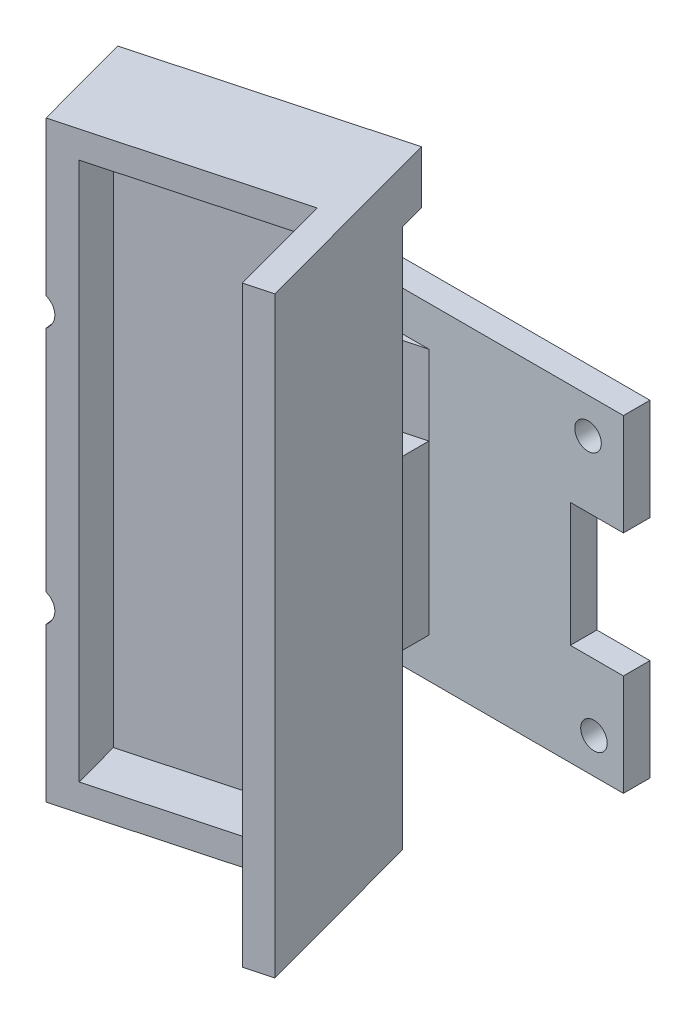
from build123d import *

# Parameters (mm, degrees)
CROQUIS1_W              = 52
CROQUIS1_H              = 37
SALIENTE_EXTRUIR1_DEPTH = 3
REDONDEO1_R             = 3
CROQUIS2_R              = 1.5
CORTAR_EXTRUIR1_DEPTH   = 3
CROQUIS3_W              = 29
CROQUIS3_H              = 20
CROQUIS3_W_2            = 6
CROQUIS3_H_2            = 14
CORTAR_EXTRUIR2_DEPTH   = 3
SALIENTE_EXTRUIR2_DEPTH = 9
CROQUIS5_W              = 36
CROQUIS5_H              = 28.002550662
SALIENTE_EXTRUIR3_DEPTH = 10.3
CORTAR_EXTRUIR3_START   = -28.002551
CORTAR_EXTRUIR3_DEPTH   = 28.002551
SALIENTE_EXTRUIR4_DEPTH = 8.5
CROQUIS8_W              = 21.9
CROQUIS8_H              = 60.9
CORTAR_EXTRUIR4_DEPTH   = 5.5
CORTAR_EXTRUIR5_DEPTH   = 9
CORTAR_EXTRUIR6_START   = -28.002551
CROQUIS12_W             = 9
CROQUIS12_H             = 1.570892211
CORTAR_EXTRUIR6_DEPTH   = 28.002551
CROQUIS13_W             = 3
CROQUIS13_H             = 67
SALIENTE_EXTRUIR5_DEPTH = 12
CORTAR_EXTRUIR7_START   = -28.002551
CROQUIS14_W             = 31
CROQUIS14_H             = 9
CORTAR_EXTRUIR7_DEPTH   = 28.002551
CROQUIS17_R             = 1.5
SALIENTE_EXTRUIR6_DEPTH = 9
CORTAR_EXTRUIR8_START   = -37
CROQUIS18_W             = 54.197150846
CROQUIS18_H             = 9
CORTAR_EXTRUIR8_DEPTH   = 37
CORTAR_EXTRUIR9_REACH   = 83.194
CROQUIS19_R             = 1.5
CROQUIS20_W             = 28
CROQUIS20_H             = 6
SALIENTE_EXTRUIR7_DEPTH = 3
CROQUIS21_W             = 20
CROQUIS21_H             = 4.5
CORTAR_EXTRUIR10_DEPTH  = 2
CROQUIS22_R             = 3
CORTAR_EXTRUIR11_DEPTH  = 10.3
CORTAR_EXTRUIR12_REACH  = 82.263
CROQUIS23_R             = 2


with BuildPart() as part:
    # Croquis1 → Saliente-Extruir1 (new body)
    with BuildSketch(Plane.XY):
        with Locations((-39.296803653, 6.787671233)):
            Rectangle(CROQUIS1_W, CROQUIS1_H)
    extrude(amount=SALIENTE_EXTRUIR1_DEPTH)

    # Redondeo1
    redondeo1_edges = [part.edges().sort_by_distance(p)[0] for p in [
        (-65.296803653, 25.287671233, 1.5),
        (-65.296803653, -11.712328767, 1.5),
    ]]
    fillet(redondeo1_edges, radius=REDONDEO1_R)

    # Croquis2 → Cortar-Extruir1 (cut)
    with BuildSketch(Plane.XY.offset(3)):
        with Locations((-61.296803653, 21.287671233)):
            Circle(CROQUIS2_R)
        with Locations((-61.296803653, -7.712328767)):
            Circle(CROQUIS2_R)
        with Locations((-16.624072342, -7.712328767)):
            Circle(CROQUIS2_R)
        with Locations((-17.296803653, 21.287671233)):
            Circle(CROQUIS2_R)
    extrude(amount=-CORTAR_EXTRUIR1_DEPTH, mode=Mode.SUBTRACT)

    # Croquis3 → Cortar-Extruir2 (cut)
    with BuildSketch(Plane.XY.offset(3)):
        with Locations((-50.796803653, 6.787671233)):
            Rectangle(CROQUIS3_W, CROQUIS3_H)
        with Locations((-16.296803653, 6.787671233)):
            Rectangle(CROQUIS3_W_2, CROQUIS3_H_2)
    extrude(amount=-CORTAR_EXTRUIR2_DEPTH, mode=Mode.SUBTRACT)

    # Croquis4 → Saliente-Extruir2 (add)
    with BuildSketch(Plane.XY.offset(3)):
        Polygon((-57.296803653, 16.787671233), (-57.296803653, 20.790221895), (-26.296803653, 20.790221895), (-26.296803653, -7.212328767), (-57.296803653, -7.212328767), (-57.296803653, -3.212328767), (-36.296803653, -3.212328767), (-36.296803653, 16.787671233), align=None)
    extrude(amount=SALIENTE_EXTRUIR2_DEPTH)

    # Croquis5 → Saliente-Extruir3 (add)
    with BuildSketch(Plane.XY.offset(12)):
        with Locations((-44.296803653, 6.788946564)):
            Rectangle(CROQUIS5_W, CROQUIS5_H)
    extrude(amount=SALIENTE_EXTRUIR3_DEPTH)

    # Croquis6 → Cortar-Extruir3 (cut)
    with BuildSketch(Plane.XZ.offset(7.212328767).offset(CORTAR_EXTRUIR3_START)):
        Polygon((-35.296803653, 15), (-35.296803653, 12.995381041), (-26.296803653, 12.995381041), (-26.296803653, 14.757444162), (-26.296803653, 22.3), (-62.296803653, 22.3), align=None)
    extrude(amount=CORTAR_EXTRUIR3_DEPTH, mode=Mode.SUBTRACT)

    # Croquis7 → Saliente-Extruir4 (add)
    with BuildSketch(Plane(origin=(1.374852463, 0, 5.085070754), x_dir=(0.9653390502996949, 0, -0.2609990765625102), z_dir=(0.2609990765625102, 0, 0.9653390502996949))):
        Polygon((-65.957816682, 6.788946564), (-65.957816682, -26.711053436), (-37.957816682, -26.711053436), (-37.957816682, 40.288946564), (-65.957816682, 40.288946564), align=None)
    extrude(amount=SALIENTE_EXTRUIR4_DEPTH)

    # Croquis8 → Cortar-Extruir4 (cut)
    with BuildSketch(Plane(origin=(3.593344614, 0, 13.290452681), x_dir=(0.9653390502996949, 0, -0.26099907656251026), z_dir=(0.26099907656251026, 0, 0.9653390502996949))):
        with Locations((-51.957816682, 6.788946564)):
            Rectangle(CROQUIS8_W, CROQUIS8_H)
    extrude(amount=-CORTAR_EXTRUIR4_DEPTH, mode=Mode.SUBTRACT)

    # Croquis10 → Cortar-Extruir5 (cut)
    with BuildSketch(Plane(origin=(0, 20.790221895, 0), x_dir=(1, 0, 0), z_dir=(0, 1, 0))):
        Polygon((-62.296803653, -22.3), (-35.296803653, -15), (-35.296803653, -12), (-62.296803653, -19.3), align=None)
    extrude(amount=-CORTAR_EXTRUIR5_DEPTH, mode=Mode.SUBTRACT)

    # Croquis12 → Cortar-Extruir6 (cut)
    with BuildSketch(Plane(origin=(0, 20.790221895, 0), x_dir=(1, 0, 0), z_dir=(0, 1, 0)).offset(CORTAR_EXTRUIR6_START)):
        with Locations((-30.796803653, -12.209934936)):
            Rectangle(CROQUIS12_W, CROQUIS12_H)
    extrude(amount=CORTAR_EXTRUIR6_DEPTH, mode=Mode.SUBTRACT)

    # Croquis13 → Saliente-Extruir5 (add)
    with BuildSketch(Plane(origin=(3.593344614, 0, 13.290452681), x_dir=(0.9653390502996949, 0, -0.26099907656251026), z_dir=(0.26099907656251026, 0, 0.9653390502996949))):
        with Locations((-39.457816682, 6.788946564)):
            Rectangle(CROQUIS13_W, CROQUIS13_H)
    extrude(amount=SALIENTE_EXTRUIR5_DEPTH)

    # Croquis14 → Cortar-Extruir7 (cut)
    with BuildSketch(Plane.XZ.offset(7.212328767).offset(CORTAR_EXTRUIR7_START)):
        with Locations((-41.796803653, 7.5)):
            Rectangle(CROQUIS14_W, CROQUIS14_H)
    extrude(amount=CORTAR_EXTRUIR7_DEPTH, mode=Mode.SUBTRACT)


with BuildPart() as cortar_extruir7_piece_1:
    # of the separate pieces the step leaves, piece 1, a body of its own (cortar_extruir7_pieces)
    add(part.part.solids().sort_by_distance((-62.296803653, -26.711053436, 22.3))[0])



with BuildPart() as cortar_extruir7_piece_2:
    # of the separate pieces the step leaves, piece 2, a body of its own (cortar_extruir7_pieces)
    add(part.part.solids().sort_by_distance((-62.296803653, 25.287671233, 3))[0])


with BuildPart() as cortar_extruir7_piece_1_1:
    add(cortar_extruir7_piece_1.part)

    add(cortar_extruir7_piece_2.part)  # Saliente-Extruir6 merges Cortar-Extruir7 piece 2
    # Croquis17 → Saliente-Extruir6 (add)
    with BuildSketch(Plane.XY.offset(3)):
        with BuildLine():
            Line((-13.296803653, -0.212328767), (-19.296803653, -0.212328767))
            Line((-19.296803653, -0.212328767), (-19.296803653, 13.787671233))
            Line((-19.296803653, 13.787671233), (-13.296803653, 13.787671233))
            Line((-13.296803653, 13.787671233), (-13.296803653, 25.287671233))
            Line((-13.296803653, 25.287671233), (-62.296803653, 25.287671233))
            ThreePointArc((-62.296803653, 25.287671233), (-64.418123997, 24.408991576), (-65.296803653, 22.287671233))
            Line((-65.296803653, 22.287671233), (-65.296803653, 16.787671233))
            Line((-65.296803653, 16.787671233), (-36.296803653, 16.787671233))
            Line((-36.296803653, 16.787671233), (-36.296803653, -3.212328767))
            Line((-36.296803653, -3.212328767), (-65.296803653, -3.212328767))
            Line((-65.296803653, -3.212328767), (-65.296803653, -8.712328767))
            ThreePointArc((-65.296803653, -8.712328767), (-64.418123997, -10.833649111), (-62.296803653, -11.712328767))
            Line((-62.296803653, -11.712328767), (-13.296803653, -11.712328767))
            Line((-13.296803653, -11.712328767), (-13.296803653, -0.212328767))
        make_face()
        with Locations((-61.296803653, 21.287671233)):
            Circle(CROQUIS17_R, mode=Mode.SUBTRACT)
        with Locations((-61.296803653, -7.712328767)):
            Circle(CROQUIS17_R, mode=Mode.SUBTRACT)
        with Locations((-16.624072342, -7.712328767)):
            Circle(CROQUIS17_R, mode=Mode.SUBTRACT)
        with Locations((-17.296803653, 21.287671233)):
            Circle(CROQUIS17_R, mode=Mode.SUBTRACT)
    extrude(amount=SALIENTE_EXTRUIR6_DEPTH)

    # Croquis18 → Cortar-Extruir8 (cut)
    with BuildSketch(Plane.XZ.offset(11.712328767).offset(CORTAR_EXTRUIR8_START)):
        with Locations((-40.395379076, 4.5)):
            Rectangle(CROQUIS18_W, CROQUIS18_H)
    extrude(amount=CORTAR_EXTRUIR8_DEPTH, mode=Mode.SUBTRACT)

    # Cortar-Extruir9: up to this plane
    cortar_extruir9_end = Plane(origin=(3.593344614, 0, 13.290452681), z_dir=(0.26099907656251026, 0, 0.9653390502996949))
    # Croquis19 → Cortar-Extruir9 (cut, up to the surface)
    with BuildSketch(Plane(origin=(0, 0, 9), x_dir=(-1, 0, 0), z_dir=(0, 0, -1)), mode=Mode.PRIVATE) as cortar_extruir9_sk1:
        with Locations(Location((61.296803653, 21.287671233, 0), (0, 0, 180))):
            Circle(CROQUIS19_R)
    cortar_extruir9_tool1 = split(extrude(cortar_extruir9_sk1.sketch, amount=-CORTAR_EXTRUIR9_REACH, mode=Mode.PRIVATE), bisect_by=cortar_extruir9_end, keep=Keep.BOTH, mode=Mode.PRIVATE)
    add(cortar_extruir9_tool1.solids().sort_by_distance((-61.296804, 21.287671, 9))[0], mode=Mode.SUBTRACT)
    # Croquis19 → Cortar-Extruir9 (cut, up to the surface)
    with BuildSketch(Plane(origin=(0, 0, 9), x_dir=(-1, 0, 0), z_dir=(0, 0, -1)), mode=Mode.PRIVATE) as cortar_extruir9_sk2:
        with Locations(Location((61.296803653, -7.712328767, 0), (0, 0, 180))):
            Circle(CROQUIS19_R)
    cortar_extruir9_tool2 = split(extrude(cortar_extruir9_sk2.sketch, amount=-CORTAR_EXTRUIR9_REACH, mode=Mode.PRIVATE), bisect_by=cortar_extruir9_end, keep=Keep.BOTH, mode=Mode.PRIVATE)
    add(cortar_extruir9_tool2.solids().sort_by_distance((-61.296804, -7.712329, 9))[0], mode=Mode.SUBTRACT)

    # Croquis20 → Saliente-Extruir7 (add)
    with BuildSketch(Plane(origin=(1.374852463, 0, 5.085070754), x_dir=(-0.9653390502996949, 0, 0.26099907656251026), z_dir=(-0.26099907656251026, 0, -0.9653390502996949))):
        with Locations((51.957816682, 37.288946564)):
            Rectangle(CROQUIS20_W, CROQUIS20_H)
    extrude(amount=SALIENTE_EXTRUIR7_DEPTH)

    # Croquis21 → Cortar-Extruir10 (cut)
    with BuildSketch(Plane(origin=(0, 0, 9), x_dir=(-1, 0, 0), z_dir=(0, 0, -1))):
        with Locations((45.296803653, 19.037671233)):
            Rectangle(CROQUIS21_W, CROQUIS21_H)
        with Locations((45.296803653, -5.462328767)):
            Rectangle(CROQUIS21_W, CROQUIS21_H)
    extrude(amount=-CORTAR_EXTRUIR10_DEPTH, mode=Mode.SUBTRACT)

    # Croquis22 → Cortar-Extruir11 (cut)
    with BuildSketch(Plane.XY.offset(12)):
        with Locations((-61.296803653, 21.287671233)):
            Circle(CROQUIS22_R)
        with Locations((-61.296803653, -7.712328767)):
            Circle(CROQUIS22_R)
    extrude(amount=CORTAR_EXTRUIR11_DEPTH, mode=Mode.SUBTRACT)

    # Cortar-Extruir12: up to this plane
    cortar_extruir12_end = Plane(origin=(3.593344614, 0, 13.290452681), z_dir=(0.26099907656251026, 0, 0.9653390502996949))
    # Croquis23 → Cortar-Extruir12 (cut, up to the surface)
    with BuildSketch(Plane.XY.offset(12), mode=Mode.PRIVATE) as cortar_extruir12_sk1:
        with Locations((-61.296803653, 21.287671233)):
            Circle(CROQUIS23_R)
    cortar_extruir12_tool1 = split(extrude(cortar_extruir12_sk1.sketch, amount=CORTAR_EXTRUIR12_REACH, mode=Mode.PRIVATE), bisect_by=cortar_extruir12_end, keep=Keep.BOTH, mode=Mode.PRIVATE)
    add(cortar_extruir12_tool1.solids().sort_by_distance((-61.296804, 21.287671, 12))[0], mode=Mode.SUBTRACT)
    # Croquis23 → Cortar-Extruir12 (cut, up to the surface)
    with BuildSketch(Plane.XY.offset(12), mode=Mode.PRIVATE) as cortar_extruir12_sk2:
        with Locations((-61.296803653, -7.712328767)):
            Circle(CROQUIS23_R)
    cortar_extruir12_tool2 = split(extrude(cortar_extruir12_sk2.sketch, amount=CORTAR_EXTRUIR12_REACH, mode=Mode.PRIVATE), bisect_by=cortar_extruir12_end, keep=Keep.BOTH, mode=Mode.PRIVATE)
    add(cortar_extruir12_tool2.solids().sort_by_distance((-61.296804, -7.712329, 12))[0], mode=Mode.SUBTRACT)


solid = cortar_extruir7_piece_1_1.part
